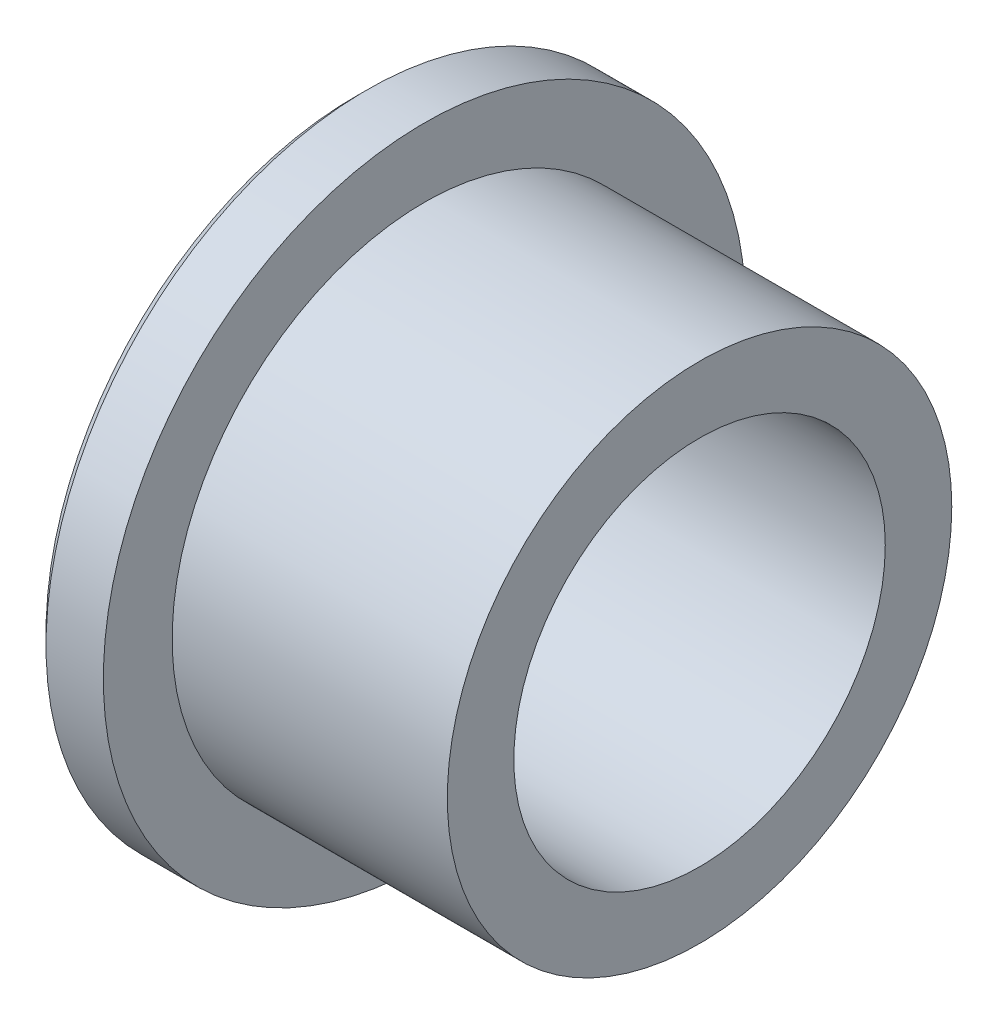
from build123d import *

# Parameters (mm, degrees)
SZKIC1_R                    = 14
SZKIC1_R_2                  = 8.1
DODANIE_WYCI_GNI_CIE1_DEPTH = 3
SZKIC2_R                    = 11
SZKIC2_R_2                  = 8.1
DODANIE_WYCI_GNI_CIE2_DEPTH = 12
SFAZOWANIE1_SIZE            = 0.5


with BuildPart() as part:
    # Szkic1 → Dodanie-wyciągnięcie1 (new body)
    with BuildSketch(Plane(origin=(0, 0, 0), x_dir=(0, 0, -1), z_dir=(1, 0, 0))):
        Circle(SZKIC1_R)
        Circle(SZKIC1_R_2, mode=Mode.SUBTRACT)
    extrude(amount=DODANIE_WYCI_GNI_CIE1_DEPTH)

    # Szkic2 → Dodanie-wyciągnięcie2 (add)
    with BuildSketch(Plane(origin=(3, 0, 0), x_dir=(0, 0, -1), z_dir=(1, 0, 0))):
        Circle(SZKIC2_R)
        Circle(SZKIC2_R_2, mode=Mode.SUBTRACT)
    extrude(amount=DODANIE_WYCI_GNI_CIE2_DEPTH)

    # Sfazowanie1
    sfazowanie1_edges = [part.edges().sort_by_distance(p)[0] for p in [
        (0, 0, 14),
    ]]
    chamfer(sfazowanie1_edges, length=SFAZOWANIE1_SIZE)


solid = part.part
